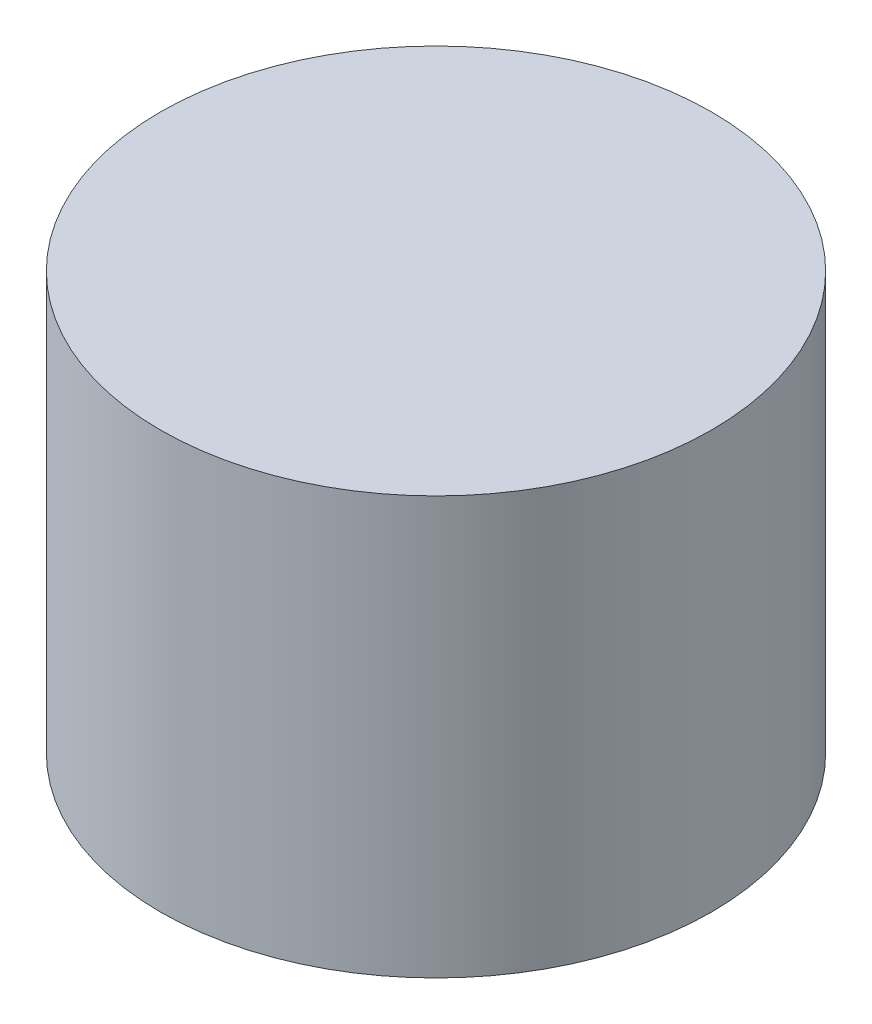
from build123d import *

# Parameters (mm, degrees)
SKETCH_1_R      = 66
EXTRUDE_1_DEPTH = 100


with BuildPart() as part:
    # Эскиз1 → Бобышка-Вытянуть1 (new body)
    with BuildSketch(Plane(origin=(0, 0, 0), x_dir=(1, 0, 0), z_dir=(0, 1, 0))):
        with Locations(Location((0, 0, 0), (0, 0, 270))):
            Circle(SKETCH_1_R)
    extrude(amount=EXTRUDE_1_DEPTH)


solid = part.part
